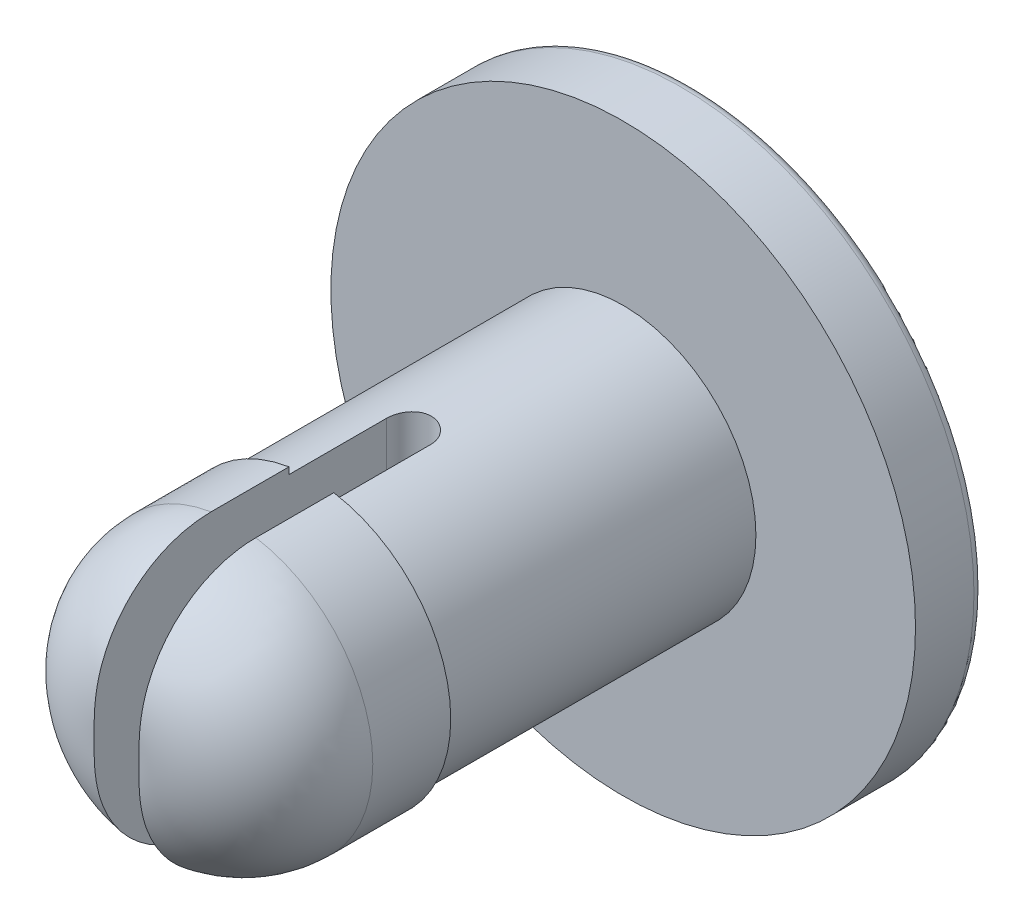
from build123d import *

# Parameters (mm, degrees)
SKETCH2_R               = 7.5
BOSS_EXTRUDE1_DEPTH     = 1.75
FILLET1_R               = 0.25
SKETCH3_R               = 3.405
BOSS_EXTRUDE2_DEPTH     = 8
SKETCH4_R               = 3.575
BOSS_EXTRUDE3_DEPTH     = 5
FILLET3_R               = 3
CUT_EXTRUDE1_DEPTH      = 19.167622299
CUT_EXTRUDE1_DEPTH_BACK = 19.167622299


with BuildPart() as part:
    # Sketch2 → Boss-Extrude1 (new body)
    with BuildSketch(Plane.XY):
        Circle(SKETCH2_R)
    extrude(amount=BOSS_EXTRUDE1_DEPTH)

    # Fillet1
    fillet1_edges = [part.edges().sort_by_distance(p)[0] for p in [
        (-7.5, 0, 0),
    ]]
    fillet(fillet1_edges, radius=FILLET1_R)

    # Sketch3 → Boss-Extrude2 (add)
    with BuildSketch(Plane.XY.offset(1.75)):
        Circle(SKETCH3_R)
    extrude(amount=BOSS_EXTRUDE2_DEPTH)

    # Sketch4 → Boss-Extrude3 (add)
    with BuildSketch(Plane.XY.offset(9.75)):
        Circle(SKETCH4_R)
    extrude(amount=BOSS_EXTRUDE3_DEPTH)

    # Fillet3
    fillet3_edges = [part.edges().sort_by_distance(p)[0] for p in [
        (-3.575, 0, 14.75),
    ]]
    fillet(fillet3_edges, radius=FILLET3_R)

    # Sketch5 → Cut-Extrude1 (cut, two sides: drawn at the far end of the back side and taken through both)
    with BuildSketch(Plane(origin=(0, 0, 0), x_dir=(1, 0, 0), z_dir=(0, 1, 0)).offset(-CUT_EXTRUDE1_DEPTH_BACK)):
        with BuildLine():
            Line((0.575, -14.75), (0.575, -7.25))
            ThreePointArc((0.575, -7.25), (0, -6.675), (-0.575, -7.25))
            Line((-0.575, -7.25), (-0.575, -14.75))
            Line((-0.575, -14.75), (0.575, -14.75))
        make_face()
    extrude(amount=CUT_EXTRUDE1_DEPTH + CUT_EXTRUDE1_DEPTH_BACK, mode=Mode.SUBTRACT)


solid = part.part
